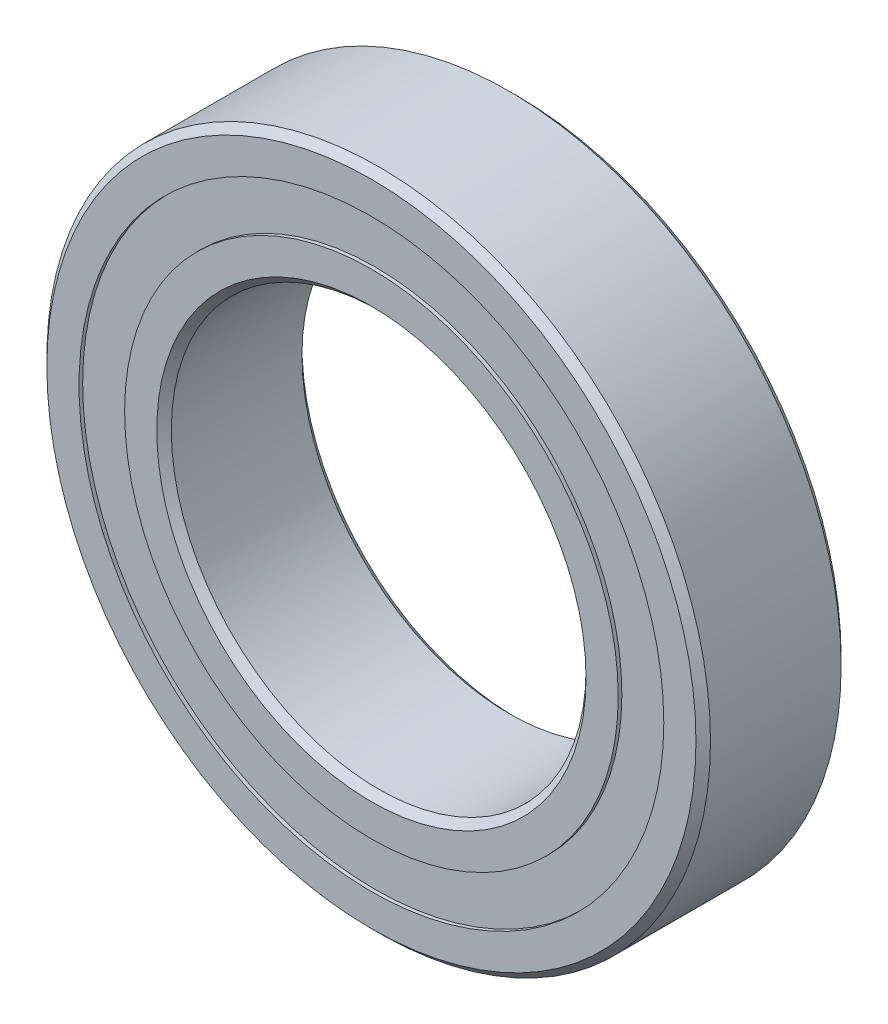
from build123d import *

# Parameters (mm, degrees)
CIRPATTERN1_COUNT = 12
SKETCH5_W         = 1.4204431718675923
SKETCH5_H         = 2.1978021978022024
SKETCH5_W_2       = 1.420443171867592


with BuildPart() as part:
    # Sketch6 → Revolve1 (revolve)
    with BuildSketch(Plane(origin=(0, 0, 0), x_dir=(0, 0, -1), z_dir=(1, 0, 0))):
        with BuildLine():
            Line((-3.4999999999999996, 15.650000000000004), (-3.4999999999999996, 14.098901098901106))
            Line((-3.4999999999999996, 14.098901098901106), (-1.5555555555555556, 14.098901098901106))
            ThreePointArc((-1.5555555555555556, 14.098901098901106), (1.2e-16, 14.904556828132419), (1.5555555555555556, 14.098901098901106))
            Line((1.5555555555555556, 14.098901098901106), (3.4999999999999996, 14.098901098901106))
            Line((3.4999999999999996, 14.098901098901106), (3.4999999999999996, 15.64999999999999))
            Line((3.4999999999999996, 15.64999999999999), (3.1499999999999972, 16))
            Line((3.1499999999999972, 16), (-3.1499999999999972, 15.999999999999993))
            Line((-3.1499999999999972, 15.999999999999993), (-3.4999999999999996, 15.650000000000004))
        make_face()
        with BuildLine():
            Line((-3.4999999999999996, 10.35000000000002), (-3.4999999999999996, 11.901098901098903))
            Line((-3.4999999999999996, 11.901098901098903), (-1.5555555555555556, 11.901098901098903))
            ThreePointArc((-1.5555555555555556, 11.901098901098903), (-3.1e-16, 11.095443171867592), (1.5555555555555556, 11.901098901098903))
            Line((1.5555555555555556, 11.901098901098903), (3.4999999999999996, 11.901098901098903))
            Line((3.4999999999999996, 11.901098901098903), (3.4999999999999996, 10.35000000000002))
            Line((3.4999999999999996, 10.35000000000002), (3.149999999999999, 10.000000000000009))
            Line((3.149999999999999, 10.000000000000009), (-3.149999999999999, 10.000000000000009))
            Line((-3.149999999999999, 10.000000000000009), (-3.4999999999999996, 10.35000000000002))
        make_face()
    revolve(axis=Axis((0, 0, 3.4999999999999996), (0, 0, -1)))



with BuildPart() as body_2:
    # Sketch4 → Revolve2 (revolve)
    with BuildSketch(Plane(origin=(0, 0, 0), x_dir=(0, 0, -1), z_dir=(1, 0, 0))):
        with BuildLine():
            Line((-1.9045568281324141, 13.000000000000005), (1.9045568281324141, 13.000000000000005))
            ThreePointArc((1.9045568281324141, 13.000000000000005), (1.2e-16, 14.904556828132419), (-1.9045568281324141, 13.000000000000005))
        make_face()
    revolve(axis=Axis((0, 13.000000000000005, 1.9045568281324141), (0, 0, -1)))


with BuildPart() as cirpattern1_1:
    # CirPattern1: pattern copy
    add(body_2.part.rotate(Axis((0, 0, -3.4999999999999996), (0, 0, 1)), 1 * 360 / CIRPATTERN1_COUNT))


with BuildPart() as cirpattern1_2:
    # CirPattern1: pattern copy
    add(body_2.part.rotate(Axis((0, 0, -3.4999999999999996), (0, 0, 1)), 2 * 360 / CIRPATTERN1_COUNT))


with BuildPart() as cirpattern1_3:
    # CirPattern1: pattern copy
    add(body_2.part.rotate(Axis((0, 0, -3.4999999999999996), (0, 0, 1)), 3 * 360 / CIRPATTERN1_COUNT))


with BuildPart() as cirpattern1_4:
    # CirPattern1: pattern copy
    add(body_2.part.rotate(Axis((0, 0, -3.4999999999999996), (0, 0, 1)), 4 * 360 / CIRPATTERN1_COUNT))


with BuildPart() as cirpattern1_5:
    # CirPattern1: pattern copy
    add(body_2.part.rotate(Axis((0, 0, -3.4999999999999996), (0, 0, 1)), 5 * 360 / CIRPATTERN1_COUNT))


with BuildPart() as cirpattern1_6:
    # CirPattern1: pattern copy
    add(body_2.part.rotate(Axis((0, 0, -3.4999999999999996), (0, 0, 1)), 6 * 360 / CIRPATTERN1_COUNT))


with BuildPart() as cirpattern1_7:
    # CirPattern1: pattern copy
    add(body_2.part.rotate(Axis((0, 0, -3.4999999999999996), (0, 0, 1)), 7 * 360 / CIRPATTERN1_COUNT))


with BuildPart() as cirpattern1_8:
    # CirPattern1: pattern copy
    add(body_2.part.rotate(Axis((0, 0, -3.4999999999999996), (0, 0, 1)), 8 * 360 / CIRPATTERN1_COUNT))


with BuildPart() as cirpattern1_9:
    # CirPattern1: pattern copy
    add(body_2.part.rotate(Axis((0, 0, -3.4999999999999996), (0, 0, 1)), 9 * 360 / CIRPATTERN1_COUNT))


with BuildPart() as cirpattern1_10:
    # CirPattern1: pattern copy
    add(body_2.part.rotate(Axis((0, 0, -3.4999999999999996), (0, 0, 1)), 10 * 360 / CIRPATTERN1_COUNT))


with BuildPart() as cirpattern1_11:
    # CirPattern1: pattern copy
    add(body_2.part.rotate(Axis((0, 0, -3.4999999999999996), (0, 0, 1)), 11 * 360 / CIRPATTERN1_COUNT))


with BuildPart() as part_1:
    add(part.part)

    add(body_2.part)  # Revolve3 merges body 2

    add(cirpattern1_1.part)  # Revolve3 merges CirPattern1_1

    add(cirpattern1_2.part)  # Revolve3 merges CirPattern1_2

    add(cirpattern1_3.part)  # Revolve3 merges CirPattern1_3

    add(cirpattern1_4.part)  # Revolve3 merges CirPattern1_4

    add(cirpattern1_5.part)  # Revolve3 merges CirPattern1_5

    add(cirpattern1_6.part)  # Revolve3 merges CirPattern1_6

    add(cirpattern1_7.part)  # Revolve3 merges CirPattern1_7

    add(cirpattern1_8.part)  # Revolve3 merges CirPattern1_8

    add(cirpattern1_9.part)  # Revolve3 merges CirPattern1_9

    add(cirpattern1_10.part)  # Revolve3 merges CirPattern1_10

    add(cirpattern1_11.part)  # Revolve3 merges CirPattern1_11
    # Sketch5 → Revolve3 (revolve)
    with BuildSketch(Plane(origin=(0, 0, 0), x_dir=(0, 0, -1), z_dir=(1, 0, 0))):
        with Locations((-2.614778414066209, 13.000000000000004)):
            Rectangle(SKETCH5_W, SKETCH5_H)
        with Locations((2.614778414066211, 13.000000000000004)):
            Rectangle(SKETCH5_W_2, SKETCH5_H)
    revolve(axis=Axis((0, 0, 3.4999999999999996), (0, 0, -1)))


solid = part_1.part
